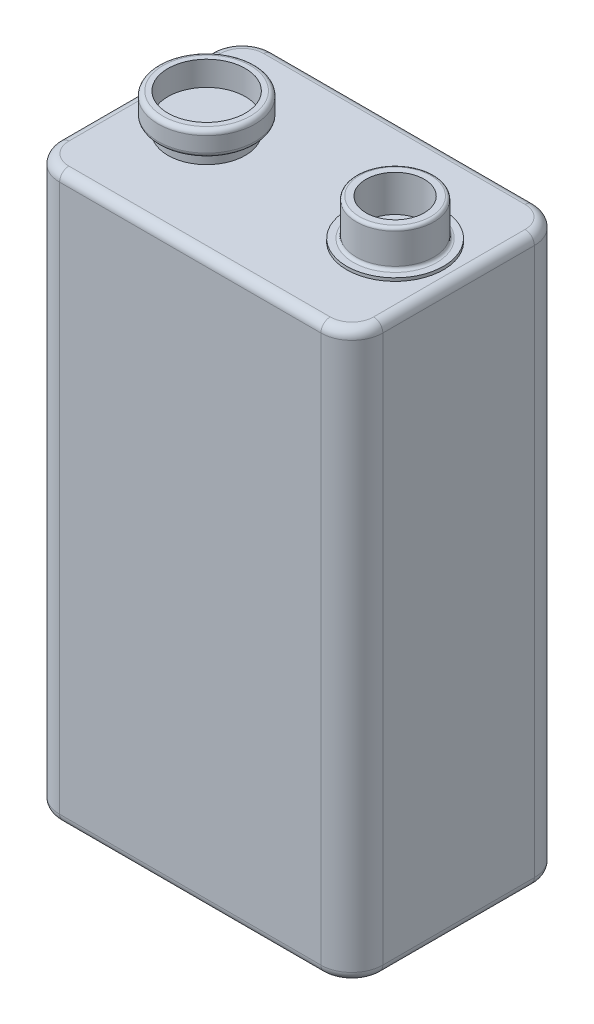
from build123d import *

# Parameters (mm, degrees)
SKETCH2_W           = 26.5
SKETCH2_H           = 46.4
BOSS_EXTRUDE1_DEPTH = 17.5
FILLET1_R           = 2.54
FILLET2_R           = 0.762
SKETCH3_R           = 3.96875
BOSS_EXTRUDE2_DEPTH = 0.254
SKETCH4_R           = 3.175
SKETCH4_R_2         = 2.3876
BOSS_EXTRUDE3_DEPTH = 3
FILLET3_R           = 0.254
SKETCH5_R           = 3.175
BOSS_EXTRUDE4_DEPTH = 1
SKETCH6_R           = 3.96875
SKETCH6_R_2         = 3.175
BOSS_EXTRUDE5_DEPTH = 2
FILLET4_R           = 0.381


with BuildPart() as part:
    # Sketch2 → Boss-Extrude1 (new body)
    with BuildSketch(Plane.XY):
        with Locations((13.25, 23.2)):
            Rectangle(SKETCH2_W, SKETCH2_H)
    extrude(amount=-BOSS_EXTRUDE1_DEPTH)

    # Fillet1
    fillet1_edges = [part.edges().sort_by_distance(p)[0] for p in [
        (26.5, 23.2, -17.5),
        (0, 23.2, -17.5),
        (26.5, 23.2, 0),
        (0, 23.2, 0),
    ]]
    fillet(fillet1_edges, radius=FILLET1_R)

    # Fillet2
    fillet2_edges = [part.edges().sort_by_distance(p)[0] for p in [
        (0, 46.4, -8.75),
        (0, 0, -8.75),
        (13.25, 0, 0),
        (13.25, 0, -17.5),
        (26.5, 0, -8.75),
        (25.756051224, 0, -0.743948776),
        (25.756051224, 0, -16.756051224),
        (0.743948776, 0, -0.743948776),
        (0.743948776, 0, -16.756051224),
        (13.25, 46.4, -17.5),
        (13.25, 46.4, 0),
        (26.5, 46.4, -8.75),
        (25.756051224, 46.4, -0.743948776),
        (25.756051224, 46.4, -16.756051224),
        (0.743948776, 46.4, -0.743948776),
        (0.743948776, 46.4, -16.756051224),
    ]]
    fillet(fillet2_edges, radius=FILLET2_R)

    # Sketch3 → Boss-Extrude2 (add)
    with BuildSketch(Plane(origin=(0, 46.4, 0), x_dir=(1, 0, 0), z_dir=(0, 1, 0))):
        with Locations(Location((21.293, 8.75, 0), (0, 0, 270))):
            Circle(SKETCH3_R)
    extrude(amount=BOSS_EXTRUDE2_DEPTH)

    # Sketch4 → Boss-Extrude3 (add)
    with BuildSketch(Plane(origin=(0, 46.654, 0), x_dir=(1, 0, 0), z_dir=(0, 1, 0))):
        with Locations(Location((21.293, 8.75, 0), (0, 0, 270))):
            Circle(SKETCH4_R)
        with Locations(Location((21.293, 8.75, 0), (0, 0, 270))):
            Circle(SKETCH4_R_2, mode=Mode.SUBTRACT)
    extrude(amount=BOSS_EXTRUDE3_DEPTH)

    # Fillet3
    fillet3_edges = [part.edges().sort_by_distance(p)[0] for p in [
        (21.293, 49.654, -11.925),
        (21.293, 46.654, -11.925),
    ]]
    fillet(fillet3_edges, radius=FILLET3_R)

    # Sketch5 → Boss-Extrude4 (add)
    with BuildSketch(Plane(origin=(0, 46.4, 0), x_dir=(1, 0, 0), z_dir=(0, 1, 0))):
        with Locations(Location((5.842, 8.75, 0), (0, 0, 270))):
            Circle(SKETCH5_R)
    extrude(amount=BOSS_EXTRUDE4_DEPTH)


with BuildPart() as body_2:
    # Sketch6 → Boss-Extrude5 (new body)
    with BuildSketch(Plane(origin=(0, 47.4, 0), x_dir=(1, 0, 0), z_dir=(0, 1, 0))):
        with Locations(Location((5.842, 8.75, 0), (0, 0, 270))):
            Circle(SKETCH6_R)
        with Locations(Location((5.842, 8.75, 0), (0, 0, 270))):
            Circle(SKETCH6_R_2, mode=Mode.SUBTRACT)
    extrude(amount=BOSS_EXTRUDE5_DEPTH)

    # Fillet4
    fillet4_edges = [body_2.edges().sort_by_distance(p)[0] for p in [
        (5.842, 47.4, -12.71875),
        (5.842, 49.4, -12.71875),
    ]]
    fillet(fillet4_edges, radius=FILLET4_R)


solid = Compound([part.part, body_2.part])
